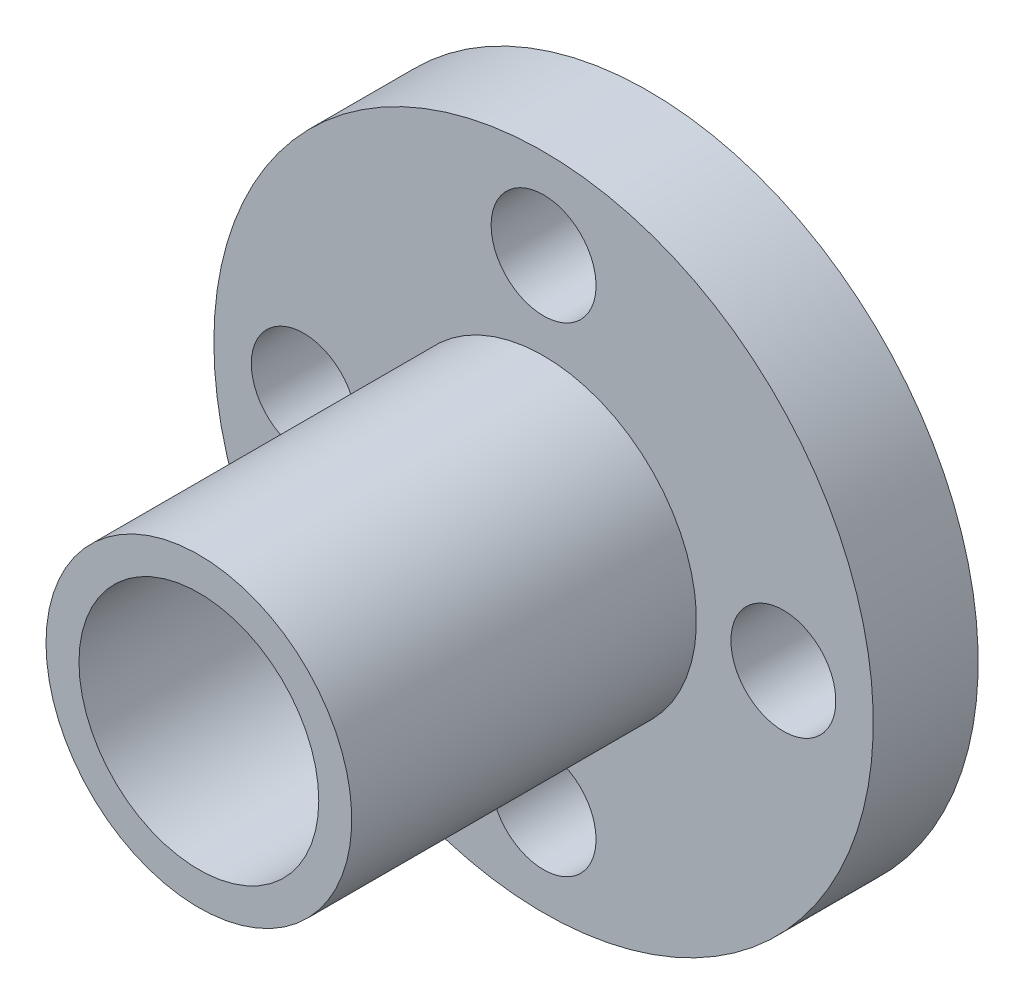
from build123d import *

# Parameters (mm, degrees)
SKETCH_2_R          = 1.75
CUT_EXTRUDE_1_DEPTH = 22.610182785


with BuildPart() as part:
    # 草图1 → 旋转1 (revolve)
    with BuildSketch(Plane(origin=(0, 0, 0), x_dir=(1, 0, 0), z_dir=(0, 1, 0)), mode=Mode.PRIVATE) as revolve_1_sk:
        Polygon((4, 15), (4, 0), (5.1, 0), (5.1, 11.5), (11, 11.5), (11, 15), align=None)
    revolve(revolve_1_sk.sketch.rotate(Axis((0, 0, -35.917436649), (0, 0, 1)), 180), axis=Axis((0, 0, -35.917436649), (0, 0, 1)))

    # 草图2 → 切除-拉伸1 (cut, through all)
    with BuildSketch(Plane(origin=(0, 0, -15), x_dir=(-1, 0, 0), z_dir=(0, 0, -1))):
        with Locations((0, 8)):
            Circle(SKETCH_2_R)
        with Locations((8, 0)):
            Circle(SKETCH_2_R)
        with Locations((0, -8)):
            Circle(SKETCH_2_R)
        with Locations((-8, 0)):
            Circle(SKETCH_2_R)
    extrude(amount=-CUT_EXTRUDE_1_DEPTH, mode=Mode.SUBTRACT)


solid = part.part
